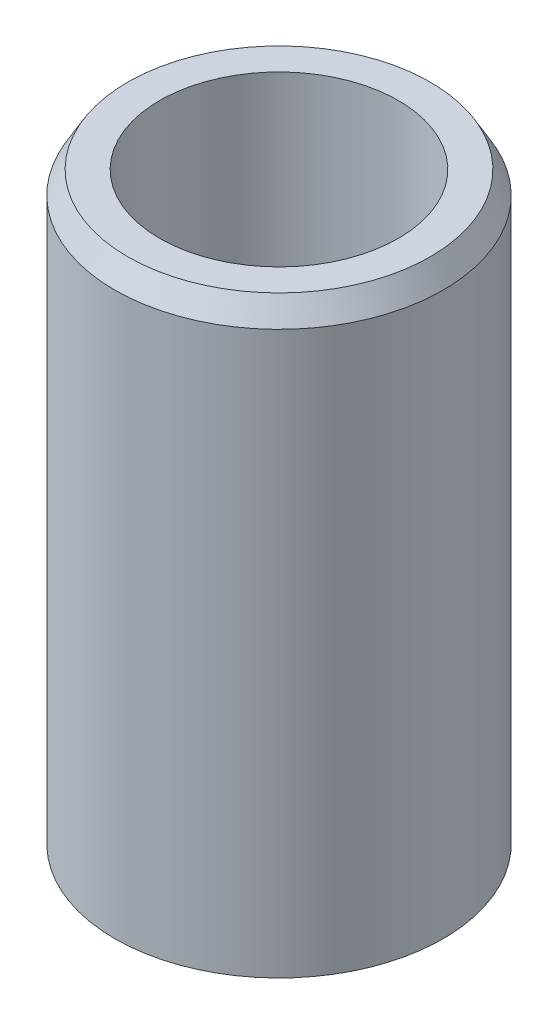
from build123d import *
from OCP.BRepFilletAPI import BRepFilletAPI_MakeChamfer

# Parameters (mm, degrees)
SKETCH1_R           = 22
SKETCH1_R_2         = 16
BOSS_EXTRUDE1_DEPTH = 80
CHAMFER1_SIZE       = 3
CHAMFER1_SIZE2      = 1.732050808


with BuildPart() as part:
    # Sketch1 → Boss-Extrude1 (new body)
    with BuildSketch(Plane(origin=(0, 0, 0), x_dir=(1, 0, 0), z_dir=(0, 1, 0))):
        with Locations(Location((0, 0, 0), (0, 0, 270))):
            Circle(SKETCH1_R)
        with Locations(Location((0, 0, 0), (0, 0, 270))):
            Circle(SKETCH1_R_2, mode=Mode.SUBTRACT)
    extrude(amount=BOSS_EXTRUDE1_DEPTH)

    # Chamfer1: one chamfer whose edges measure the first distance from different faces: ONE call of the kernel's chamfer builder (chamfer() names one face for all edges)
    chamfer1_edges_1 = [part.edges().sort_by_distance(p)[0] for p in [
        (0, 0, -22),
    ]]
    chamfer1_side_1 = [part.faces().sort_by_distance(p)[0] for p in [
        (0, 0, -21.377746033),
    ]]
    chamfer1_edges_2 = [part.edges().sort_by_distance(p)[0] for p in [
        (0, 80, -22),
    ]]
    chamfer1_side_2 = [part.faces().sort_by_distance(p)[0] for p in [
        (0, 40, -22),
    ]]
    chamfer1 = BRepFilletAPI_MakeChamfer(part.part.solid().wrapped)
    for e in chamfer1_edges_1:
        chamfer1.Add(CHAMFER1_SIZE, CHAMFER1_SIZE2, e.wrapped, chamfer1_side_1[0].wrapped)  # the first distance lies on this face
    for e in chamfer1_edges_2:
        chamfer1.Add(CHAMFER1_SIZE, CHAMFER1_SIZE2, e.wrapped, chamfer1_side_2[0].wrapped)  # the first distance lies on this face
    add(Compound.cast(chamfer1.Shape()), mode=Mode.REPLACE)


solid = part.part
